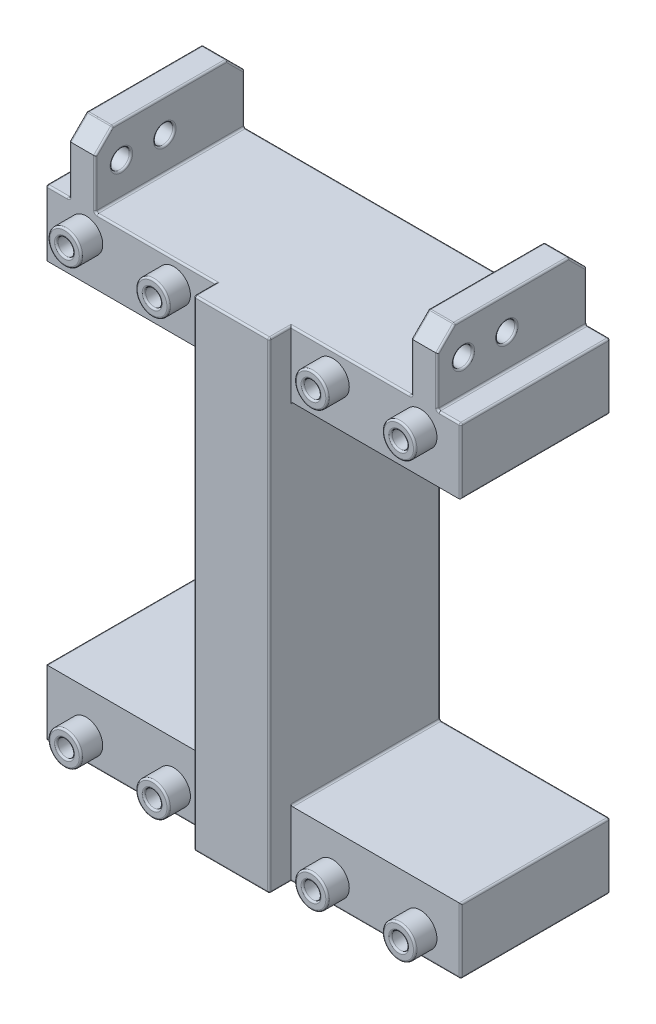
from build123d import *

# Parameters (mm, degrees)
EXTRUDE_1_DEPTH      = 8
EXTRUDE_1_DEPTH_BACK = 9.2
SKETCH_1_R           = 0.95
SKETCH_3_R           = 1.9
SKETCH_3_R_2         = 0.95
EXTRUDE_2_DEPTH      = 2.5
SKETCH_4_W           = 19.4
SKETCH_4_H           = 40
CUT_EXTRUDE_1_DEPTH  = 41.426971195
SKETCH_5_W           = 8.7
SKETCH_5_H           = 55.4
EXTRUDE_3_DEPTH      = 2.5
EXTRUDE_START        = -5.7
SKETCH_6_W           = 17.2
SKETCH_6_H           = 7.68
SKETCH_6_R           = 1.1
EXTRUDE_4_DEPTH      = 3
CHAMFER_1_SIZE       = 2
FILLET_1_R           = 0.2


with BuildPart() as part:
    # 스케치1 → 보스-돌출1 (new, two sides: drawn at the far end of the back side and taken through both)
    with BuildSketch(Plane.XY.offset(-EXTRUDE_1_DEPTH_BACK)):
        Polygon((-4.5, -20), (-4.5, 20), (-23.9, 20), (-23.9, 27.7), (23.9, 27.7), (23.9, 20), (4.5, 20), (4.5, -20), (23.9, -20), (23.9, -27.7), (-23.9, -27.7), (-23.9, -20), align=None)
        with Locations((-19.25, 25)):
            Circle(SKETCH_1_R, mode=Mode.SUBTRACT)
        with Locations((-19.25, -25)):
            Circle(SKETCH_1_R, mode=Mode.SUBTRACT)
        with Locations((-9.15, -25)):
            Circle(SKETCH_1_R, mode=Mode.SUBTRACT)
        with Locations((19.25, -25)):
            Circle(SKETCH_1_R, mode=Mode.SUBTRACT)
        with Locations((19.25, 25)):
            Circle(SKETCH_1_R, mode=Mode.SUBTRACT)
        with Locations((9.15, 25)):
            Circle(SKETCH_1_R, mode=Mode.SUBTRACT)
        with Locations((9.15, -25)):
            Circle(SKETCH_1_R, mode=Mode.SUBTRACT)
        with Locations((-9.15, 25)):
            Circle(SKETCH_1_R, mode=Mode.SUBTRACT)
    extrude(amount=EXTRUDE_1_DEPTH + EXTRUDE_1_DEPTH_BACK)

    # 스케치3 → 보스-돌출2 (add)
    # profile 1 of 8: a face of its own
    with BuildSketch(Plane.XY.offset(8)):
        with Locations((-19.25, 25)):
            Circle(SKETCH_3_R)
        with Locations((-19.25, 25)):
            Circle(SKETCH_3_R_2, mode=Mode.SUBTRACT)
    # profile 2 of 8: a face of its own
    with BuildSketch(Plane.XY.offset(8)):
        with Locations((-9.15, 25)):
            Circle(SKETCH_3_R)
        with Locations((-9.15, 25)):
            Circle(SKETCH_3_R_2, mode=Mode.SUBTRACT)
    # profile 3 of 8: a face of its own
    with BuildSketch(Plane.XY.offset(8)):
        with Locations((9.15, 25)):
            Circle(SKETCH_3_R)
        with Locations((9.15, 25)):
            Circle(SKETCH_3_R_2, mode=Mode.SUBTRACT)
    # profile 4 of 8: a face of its own
    with BuildSketch(Plane.XY.offset(8)):
        with Locations((19.25, 25)):
            Circle(SKETCH_3_R)
        with Locations((19.25, 25)):
            Circle(SKETCH_3_R_2, mode=Mode.SUBTRACT)
    # profile 5 of 8: a face of its own
    with BuildSketch(Plane.XY.offset(8)):
        with Locations((-19.25, -25)):
            Circle(SKETCH_3_R)
        with Locations((-19.25, -25)):
            Circle(SKETCH_3_R_2, mode=Mode.SUBTRACT)
    # profile 6 of 8: a face of its own
    with BuildSketch(Plane.XY.offset(8)):
        with Locations((-9.15, -25)):
            Circle(SKETCH_3_R)
        with Locations((-9.15, -25)):
            Circle(SKETCH_3_R_2, mode=Mode.SUBTRACT)
    # profile 7 of 8: a face of its own
    with BuildSketch(Plane.XY.offset(8)):
        with Locations((9.15, -25)):
            Circle(SKETCH_3_R)
        with Locations((9.15, -25)):
            Circle(SKETCH_3_R_2, mode=Mode.SUBTRACT)
    # profile 8 of 8: a face of its own
    with BuildSketch(Plane.XY.offset(8)):
        with Locations((19.25, -25)):
            Circle(SKETCH_3_R)
        with Locations((19.25, -25)):
            Circle(SKETCH_3_R_2, mode=Mode.SUBTRACT)
    extrude(amount=EXTRUDE_2_DEPTH)

    # 스케치4 → 컷-돌출1 (cut, through all)
    with BuildSketch(Plane.XY.offset(8)):
        Polygon((-4.5, 20), (-4.5, -20), (-23.9, -20), (-23.9, -20.15), (-4.35, -20.15), (-4.35, 20.15), (-23.9, 20.15), (-23.9, 20), align=None)
        Polygon((4.5, -20), (4.5, 20), (23.9, 20), (23.9, 20.15), (4.35, 20.15), (4.35, -20.15), (23.9, -20.15), (23.9, -20), align=None)
        with Locations((-14.2, 0)):
            Rectangle(SKETCH_4_W, SKETCH_4_H)
    extrude(amount=-CUT_EXTRUDE_1_DEPTH, mode=Mode.SUBTRACT)

    # 스케치5 → 보스-돌출3 (add)
    with BuildSketch(Plane.XY.offset(8)):
        Rectangle(SKETCH_5_W, SKETCH_5_H)
    extrude(amount=EXTRUDE_3_DEPTH)

    # 스케치6 → 보스-돌출4 (add)
    with BuildSketch(Plane(origin=(23.9, 0, 0), x_dir=(0, 0, -1), z_dir=(1, 0, 0)).offset(EXTRUDE_START)):
        with Locations((0.6, 31.54)):
            Rectangle(SKETCH_6_W, SKETCH_6_H)
        with Locations(Location((-5, 31.54, 0), (0, 0, 90))):
            Circle(SKETCH_6_R, mode=Mode.SUBTRACT)
        with Locations(Location((0, 31.54, 0), (0, 0, 90))):
            Circle(SKETCH_6_R, mode=Mode.SUBTRACT)
    extrude_4 = extrude(amount=EXTRUDE_4_DEPTH)

    # 대칭 복사1: 보스-돌출4 across plane
    add(extrude_4.mirror(Plane(origin=(0, 0, 0), x_dir=(0, 0, 1), z_dir=(1, 0, 0))))

    # 모따기1
    chamfer_1_edges = [part.edges().sort_by_distance(p)[0] for p in [
        (19.7, 35.38, 8),
        (19.7, 35.38, -9.2),
        (-19.7, 35.38, 8),
        (-19.7, 35.38, -9.2),
    ]]
    chamfer(chamfer_1_edges, length=CHAMFER_1_SIZE)

    # 필렛1
    fillet_1_edges = [part.edges().sort_by_distance(p)[0] for p in [
        (-21.15, 25, 10.5),
        (8.2, -25, -9.2),
        (-20.2, 25, 10.5),
        (-10.1, 25, -9.2),
        (-11.05, 25, 10.5),
        (-10.1, 25, 10.5),
        (7.25, 25, 10.5),
        (8.2, 25, 10.5),
        (17.35, 25, 10.5),
        (18.3, 25, 10.5),
        (-21.15, -25, 10.5),
        (-20.2, -25, 10.5),
        (-11.05, -25, 10.5),
        (-10.1, -25, 10.5),
        (7.25, -25, 10.5),
        (8.2, -25, 10.5),
        (-20.2, 25, -9.2),
        (17.35, -25, 10.5),
        (18.3, -25, 10.5),
        (-23.9, 23.925, -9.2),
        (23.9, 23.925, -9.2),
        (23.9, -23.925, -9.2),
        (-23.9, -23.925, -9.2),
        (-23.9, -23.925, 8),
        (23.9, -23.925, 8),
        (23.9, 23.925, 8),
        (-23.9, 23.925, 8),
        (-4.35, -20.15, -0.6),
        (-23.9, -20.15, -0.6),
        (-14.125, 20.15, -9.2),
        (-23.9, 20.15, -0.6),
        (-4.35, 0, -9.2),
        (-4.35, 20.15, -0.6),
        (-14.125, -20.15, -9.2),
        (-20.2, -25, -9.2),
        (4.35, -20.15, -0.6),
        (4.35, 20.15, -0.6),
        (23.9, 20.15, -0.6),
        (14.125, -20.15, -9.2),
        (23.9, -20.15, -0.6),
        (4.35, 0, -9.2),
        (14.125, 20.15, -9.2),
        (-14.125, -27.7, 8),
        (-11.275, 27.7, 8),
        (0, 27.7, 10.5),
        (4.35, 27.7, 9.25),
        (-4.35, 27.7, 9.25),
        (0, -27.7, 10.5),
        (-4.35, -27.7, 9.25),
        (4.35, 0, 10.5),
        (4.35, -27.7, 9.25),
        (-4.35, 0, 10.5),
        (-10.1, -25, -9.2),
        (11.275, 27.7, 8),
        (0, 27.7, -9.2),
        (21.2, 30.54, 8),
        (18.2, 27.7, -0.6),
        (18.2, 30.54, -9.2),
        (18.2, 30.44, 0),
        (18.2, 30.44, 5),
        (21.2, 30.44, 0),
        (21.2, 27.7, -0.6),
        (21.2, 30.54, -9.2),
        (21.2, 30.44, 5),
        (18.2, 30.54, 8),
        (-22.55, 27.7, -9.2),
        (-22.55, 27.7, 8),
        (-18.2, 30.54, 8),
        (-21.2, 30.54, -9.2),
        (-21.2, 27.7, -0.6),
        (-21.2, 30.44, 0),
        (-21.2, 30.44, 5),
        (-21.2, 30.54, 8),
        (-18.2, 30.44, 0),
        (-18.2, 27.7, -0.6),
        (-18.2, 30.54, -9.2),
        (-18.2, 30.44, 5),
        (18.3, -25, -9.2),
        (18.2, 35.38, -0.6),
        (18.2, 34.38, -8.2),
        (18.2, 34.38, 7),
        (21.2, 35.38, -0.6),
        (19.7, 35.38, -7.2),
        (19.7, 35.38, 6),
        (21.2, 34.38, -8.2),
        (21.2, 34.38, 7),
        (-19.7, 33.38, -9.2),
        (19.7, 33.38, -9.2),
        (-18.2, 35.38, -0.6),
        (-21.2, 35.38, -0.6),
        (-19.7, 35.38, -7.2),
        (-19.7, 35.38, 6),
        (-18.2, 34.38, -8.2),
        (-18.2, 34.38, 7),
        (-21.2, 34.38, -8.2),
        (-21.2, 34.38, 7),
        (18.3, 25, -9.2),
        (-23.9, 27.7, -0.6),
        (23.9, 27.7, -0.6),
        (23.9, -27.7, -0.6),
        (-23.9, -27.7, -0.6),
        (14.125, -27.7, 8),
        (0, -27.7, -9.2),
        (22.55, 27.7, 8),
        (22.55, 27.7, -9.2),
        (8.2, 25, -9.2),
    ]]
    fillet(fillet_1_edges, radius=FILLET_1_R)


solid = part.part
